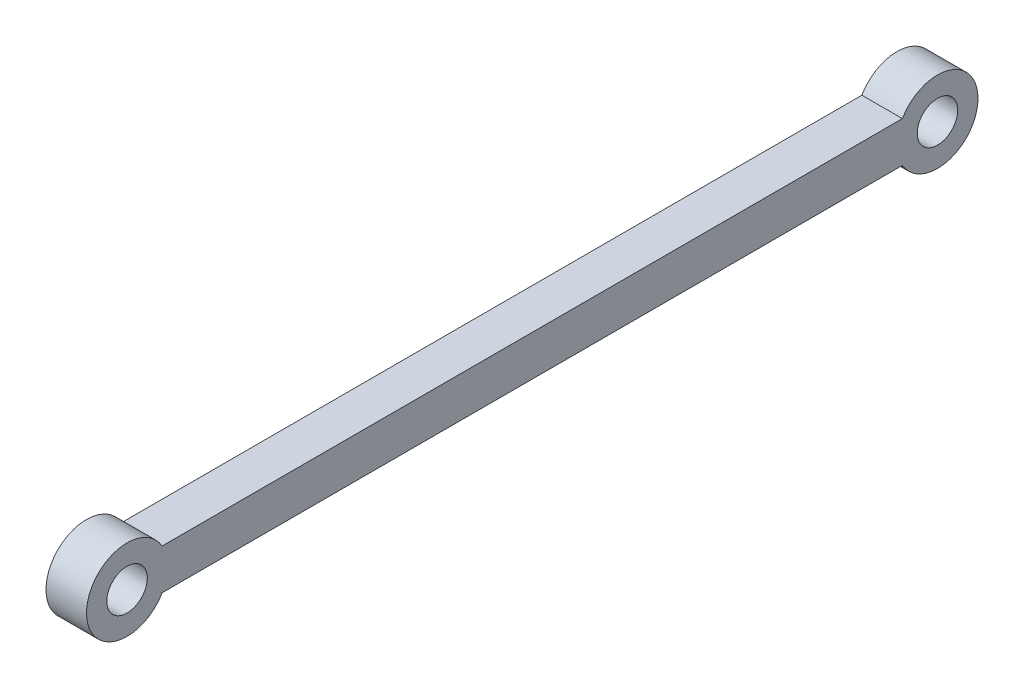
from build123d import *

# Parameters (mm, degrees)
SKETCH_1_R      = 1.25
EXTRUDE_1_DEPTH = 2.5


with BuildPart() as part:
    # 스케치1 → 보스-돌출1 (new body)
    with BuildSketch(Plane(origin=(0, 0, 0), x_dir=(0, 0, -1), z_dir=(1, 0, 0))):
        with BuildLine():
            Line((-22.834936491, 1.25), (22.834936491, 1.25))
            ThreePointArc((22.834936491, 1.25), (27.5, 0), (22.834936491, -1.25))
            Line((22.834936491, -1.25), (-22.834936491, -1.25))
            ThreePointArc((-22.834936491, -1.25), (-27.5, 0), (-22.834936491, 1.25))
        make_face()
        with Locations((-25, 0)):
            Circle(SKETCH_1_R, mode=Mode.SUBTRACT)
        with Locations((25, 0)):
            Circle(SKETCH_1_R, mode=Mode.SUBTRACT)
    extrude(amount=EXTRUDE_1_DEPTH)


solid = part.part
